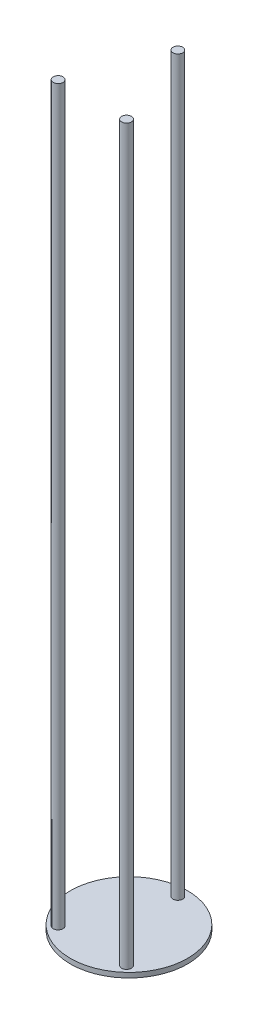
from build123d import *

# Parameters (mm, degrees)
SKETCH1_R           = 120
BOSS_EXTRUDE1_DEPTH = 10
SKETCH2_R           = 10
BOSS_EXTRUDE2_DEPTH = 1500


with BuildPart() as part:
    # Sketch1 → Boss-Extrude1 (new body)
    with BuildSketch(Plane(origin=(0, 0, 0), x_dir=(1, 0, 0), z_dir=(0, 1, 0))):
        with Locations(Location((0, 0, 0), (0, 0, 270))):
            Circle(SKETCH1_R)
    extrude(amount=BOSS_EXTRUDE1_DEPTH)

    # Sketch2 → Boss-Extrude2 (add)
    with BuildSketch(Plane(origin=(0, 10, 0), x_dir=(1, 0, 0), z_dir=(0, 1, 0))):
        with Locations(Location((0, 100, 0), (0, 0, 270))):
            Circle(SKETCH2_R)
        with Locations(Location((-70, -75, 0), (0, 0, 270))):
            Circle(SKETCH2_R)
        with Locations(Location((70, -75, 0), (0, 0, 90))):
            Circle(SKETCH2_R)
    extrude(amount=BOSS_EXTRUDE2_DEPTH)


solid = part.part
